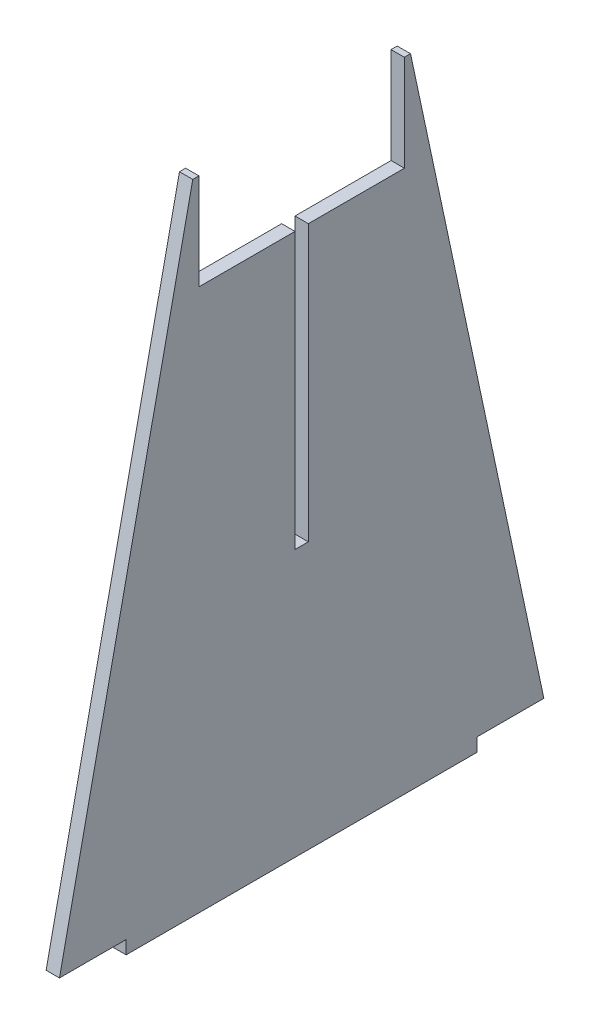
from build123d import *

# Parameters (mm, degrees)
EXTRUDE_1_DEPTH     = 3
BOSS_EXTRUDE1_DEPTH = 3


with BuildPart() as part:
    # Эскиз1 → Бобышка-Вытянуть1 (new body)
    with BuildSketch(Plane(origin=(0, 0, 0), x_dir=(0, 0, -1), z_dir=(1, 0, 0))):
        Polygon((29.113333333, 119), (54.5, 0), (39.5, 0), (39.5, -3), (-39.5, -3), (-39.5, 0), (-54.5, 0), (-29.113333333, 119), (-1.5, 119), (-1.5, 57), (1.5, 57), (1.5, 119), align=None)
    extrude(amount=EXTRUDE_1_DEPTH)

    # Sketch1 → Boss-Extrude1 (add)
    with BuildSketch(Plane(origin=(3, 0, 0), x_dir=(0, 0, -1), z_dir=(1, 0, 0))):
        Polygon((-29.113333333, 119), (-24.5, 140.625), (-23.113333333, 140.625), (-23.113333333, 119), align=None)
        Polygon((29.113333333, 119), (24.5, 140.625), (23.113333333, 140.625), (23.113333333, 119), align=None)
    extrude(amount=-BOSS_EXTRUDE1_DEPTH)


solid = part.part
